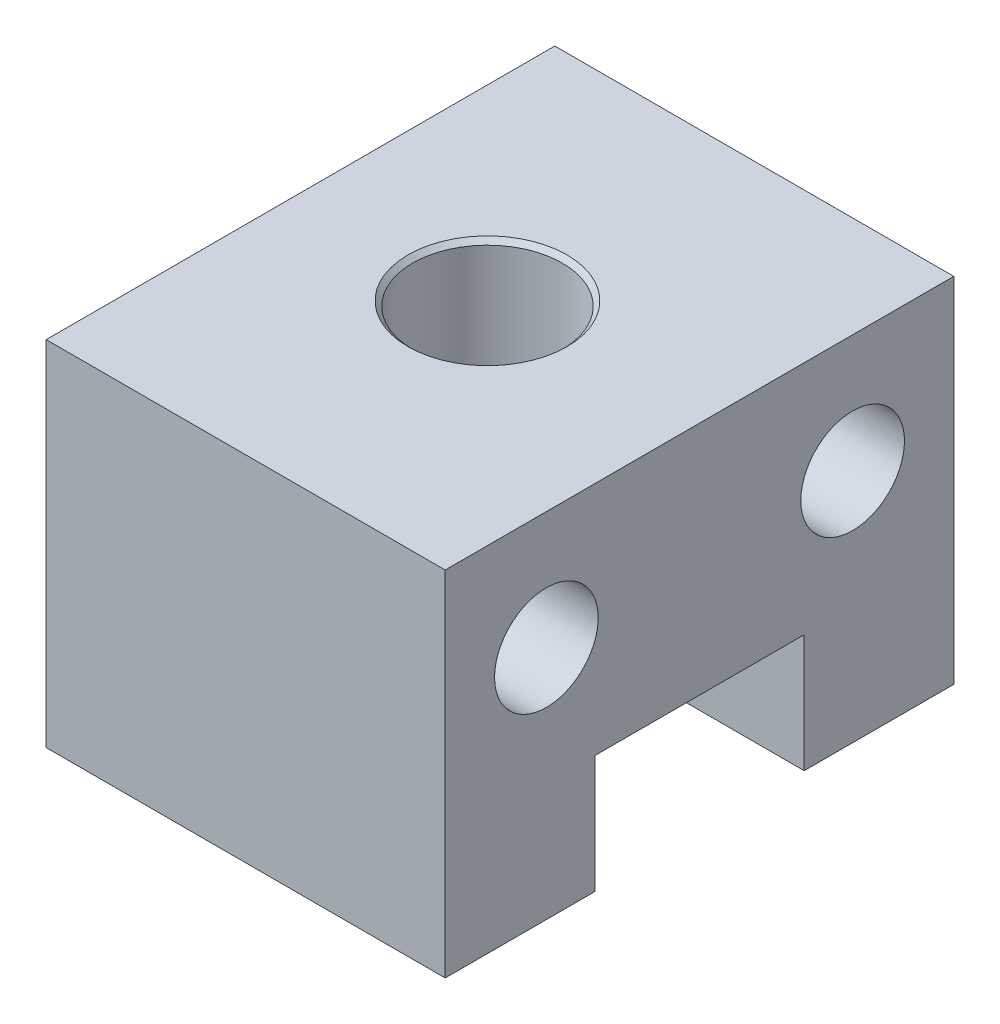
from build123d import *

# Parameters (mm, degrees)
SKETCH1_W                       = 88.9
SKETCH1_H                       = 107.95
EXTRUDE1_DEPTH                  = 75
SKETCH2_R                       = 14.2875
EXTRUDE2_DEPTH                  = 203.2
M6_TAPPED_HOLE1_D               = 5
M6_TAPPED_HOLE1_DEPTH           = 27.9908
M6_TAPPED_HOLE1_TIP             = 1.502151548
SKETCH6_R                       = 15.875
EXTRUDE4_DEPTH                  = 38.354
SKETCH7_W                       = 88.9
SKETCH7_H                       = 44.45
EXTRUDE5_DEPTH                  = 25
SKETCH8_W                       = 4.2125
SKETCH8_H                       = 107.95
EXTRUDE6_DEPTH                  = 103.538300771
CBORE_FOR_M20_SHCS1_D           = 22
CBORE_FOR_M20_SHCS1_CBORE_D     = 33
CBORE_FOR_M20_SHCS1_CBORE_DEPTH = 20
CHAMFER1_SIZE                   = 1


with BuildPart() as part:
    # Sketch1 → Extrude1 (new body)
    with BuildSketch(Plane(origin=(0, 0, 0), x_dir=(1, 0, 0), z_dir=(0, 1, 0))):
        Rectangle(SKETCH1_W, SKETCH1_H)
    extrude(amount=EXTRUDE1_DEPTH)

    # Sketch2 → Extrude2 (cut)
    with BuildSketch(Plane(origin=(0, 75, 0), x_dir=(1, 0, 0), z_dir=(0, 1, 0))):
        with Locations(Location((-4.7625, 0, 0), (0, 0, 270))):
            Circle(SKETCH2_R)
    extrude(amount=-EXTRUDE2_DEPTH, mode=Mode.SUBTRACT)

    # M6 Tapped Hole1
    with Locations(Plane.XZ):
        with Locations((-22.9235, 34.925), (13.3985, 34.925), (-22.9235, -34.925), (13.3985, -34.925)):
            Hole(M6_TAPPED_HOLE1_D / 2, depth=M6_TAPPED_HOLE1_DEPTH)
            with Locations((0, 0, -(M6_TAPPED_HOLE1_DEPTH + M6_TAPPED_HOLE1_TIP / 2))):  # 118° drill point
                Cone(0, M6_TAPPED_HOLE1_D / 2, M6_TAPPED_HOLE1_TIP, mode=Mode.SUBTRACT)

    # Sketch6 → Extrude4 (cut)
    with BuildSketch(Plane(origin=(0, 75, 0), x_dir=(1, 0, 0), z_dir=(0, 1, 0))):
        with Locations(Location((-4.7625, 0, 0), (0, 0, 270))):
            Circle(SKETCH6_R)
    extrude(amount=-EXTRUDE4_DEPTH, mode=Mode.SUBTRACT)

    # Sketch7 → Extrude5 (cut)
    with BuildSketch(Plane.XZ):
        Rectangle(SKETCH7_W, SKETCH7_H)
    extrude(amount=-EXTRUDE5_DEPTH, mode=Mode.SUBTRACT)

    # Sketch8 → Extrude6 (cut, through all)
    with BuildSketch(Plane(origin=(0, 75, 0), x_dir=(1, 0, 0), z_dir=(0, 1, 0))):
        with Locations((42.34375, 0)):
            Rectangle(SKETCH8_W, SKETCH8_H)
    extrude(amount=-EXTRUDE6_DEPTH, mode=Mode.SUBTRACT)

    # CBORE for M20 SHCS1 (through all)
    with Locations(Plane.ZY.offset(44.45)):
        with Locations((32.5, 50), (-32.5, 50)):
            CounterBoreHole(CBORE_FOR_M20_SHCS1_D / 2, CBORE_FOR_M20_SHCS1_CBORE_D / 2, CBORE_FOR_M20_SHCS1_CBORE_DEPTH)

    # Chamfer1
    chamfer1_edges = [part.edges().sort_by_distance(p)[0] for p in [
        (-4.7625, 75, -15.875),
    ]]
    chamfer(chamfer1_edges, length=CHAMFER1_SIZE)


solid = part.part
